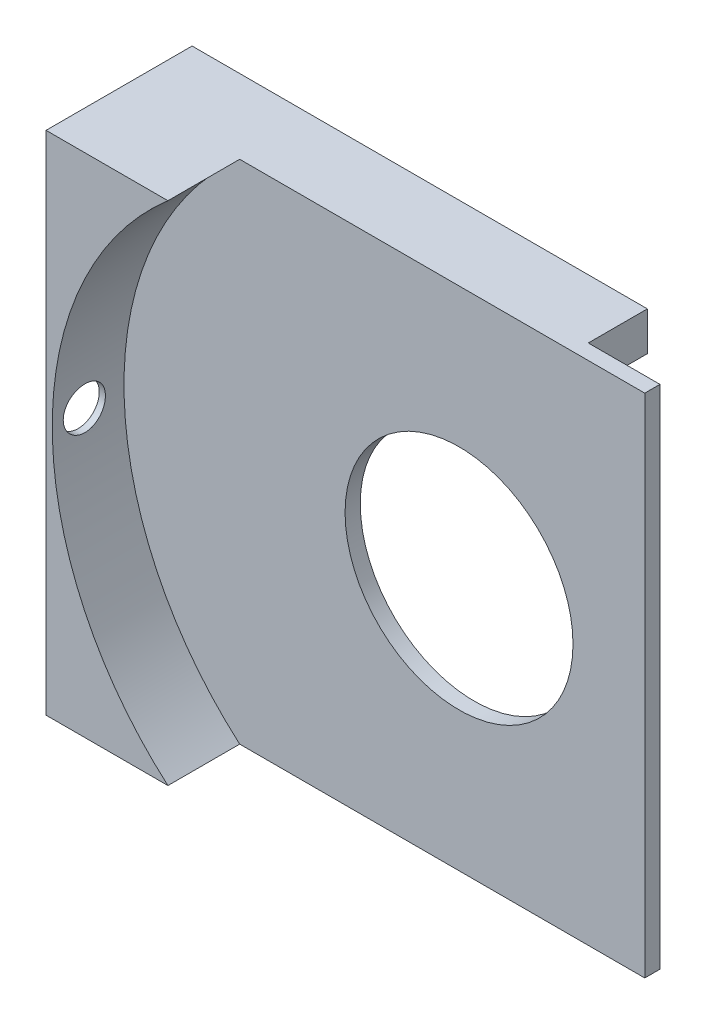
from build123d import *

# Parameters (mm, degrees)
SKETCH1_W               = 62.4208
SKETCH1_H               = 60
SKETCH1_R               = 13.5
BOSS_EXTRUDE1_DEPTH     = 1.8
BOSS_EXTRUDE2_START     = -1.8
SKETCH2_W               = 53.9308
SKETCH2_H               = 4.6
BOSS_EXTRUDE2_DEPTH     = 7
BOSS_EXTRUDE3_DEPTH     = 8.5
CUT_EXTRUDE1_REACH      = 72.058
CUT_EXTRUDE1_END_RADIUS = 39.6875
SKETCH4_R               = 2.5


with BuildPart() as part:
    # Sketch1 → Boss-Extrude1 (new body)
    with BuildSketch(Plane.XY):
        with Locations((6.283906244, 0.094262462)):
            Rectangle(SKETCH1_W, SKETCH1_H)
        with Locations((15.494306244, 0.094262462)):
            Circle(SKETCH1_R, mode=Mode.SUBTRACT)
    extrude(amount=BOSS_EXTRUDE1_DEPTH)

    # Sketch2 → Boss-Extrude2 (add)
    with BuildSketch(Plane.XY.offset(1.8).offset(BOSS_EXTRUDE2_START)):
        with Locations((2.038906244, -27.605737538)):
            Rectangle(SKETCH2_W, SKETCH2_H)
        with Locations((2.038906244, 27.794262462)):
            Rectangle(SKETCH2_W, SKETCH2_H)
    extrude(amount=-BOSS_EXTRUDE2_DEPTH)

    # Sketch3 → Boss-Extrude3 (add)
    with BuildSketch(Plane.XY.offset(1.8)):
        with BuildLine():
            ThreePointArc((-10.488335197, -29.905737538), (-19.588138729, -18.461591357), (-23.926493756, -4.49901345))
            ThreePointArc((-23.926493756, -4.49901345), (-24.193193756, 0.094262462), (-23.926493756, 4.687538375))
            ThreePointArc((-23.926493756, 4.687538375), (-19.588138729, 18.650116281), (-10.488335197, 30.094262462))
            Line((-10.488335197, 30.094262462), (-24.926493756, 30.094262462))
            Line((-24.926493756, 30.094262462), (-24.926493756, -29.905737538))
            Line((-24.926493756, -29.905737538), (-10.488335197, -29.905737538))
        make_face()
    extrude(amount=BOSS_EXTRUDE3_DEPTH)

    # Cut-Extrude1: up to this cylinder (the profile starts outside it)
    cut_extrude1_end = Plane(origin=(15.494306244, 0.094262462, 6.499), z_dir=(0, 0, -1)) * Cylinder(CUT_EXTRUDE1_END_RADIUS, 224.491, mode=Mode.PRIVATE)
    # Sketch4 → Cut-Extrude1 (cut, up to the surface)
    with BuildSketch(Plane.ZY.offset(24.926493756), mode=Mode.PRIVATE) as cut_extrude1_sk1:
        with Locations((6.499, 0.094262462)):
            Circle(SKETCH4_R)
    cut_extrude1_tool1 = extrude(cut_extrude1_sk1.sketch, amount=-CUT_EXTRUDE1_REACH, mode=Mode.PRIVATE) - cut_extrude1_end
    add(cut_extrude1_tool1.solids().sort_by_distance((-24.926494, 0.094262, 6.499))[0], mode=Mode.SUBTRACT)


solid = part.part
